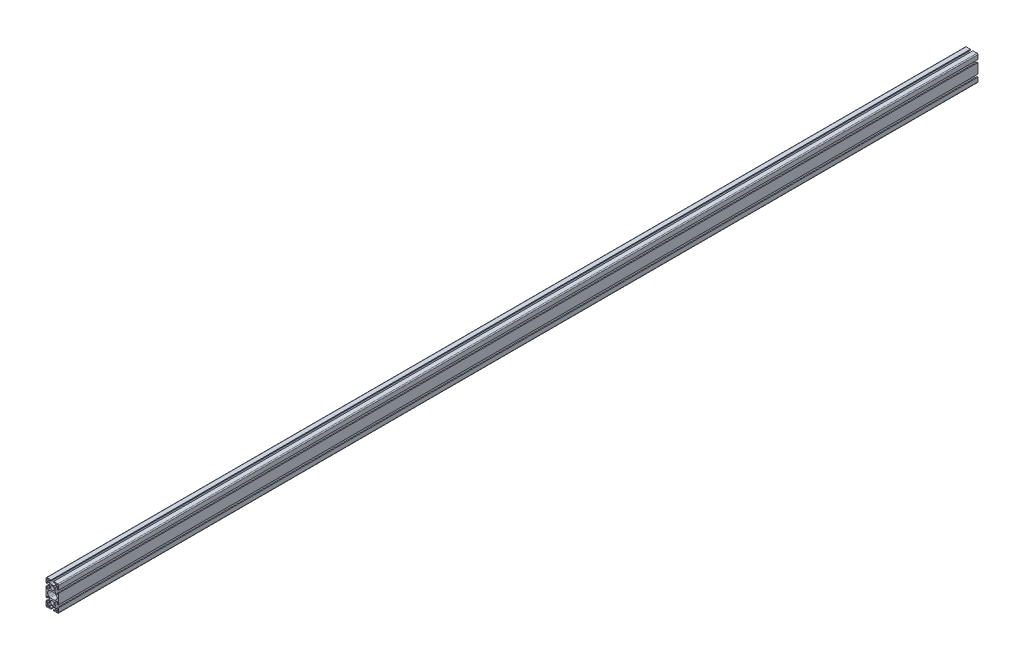
from build123d import *

# Parameters (mm, degrees)
SKETCH1_R           = 2.5
SKETCH1_R_2         = 6
BOSS_EXTRUDE1_DEPTH = 2900


with BuildPart() as part:
    # Sketch1 → Boss-Extrude1 (new body)
    with BuildSketch(Plane.XY):
        with BuildLine():
            Line((-17, -40), (-4.1, -40))
            Line((-4.1, -40), (-4.1, -37))
            Line((-4.1, -37), (-10.5, -37))
            Line((-10.5, -37), (-10.5, -33.6627417))
            ThreePointArc((-10.5, -33.6627417), (-10.378207252, -33.050448208), (-10.03137085, -32.53137085))
            Line((-10.03137085, -32.53137085), (-7.464466094, -29.964466094))
            ThreePointArc((-7.464466094, -29.964466094), (-5.84234935, -28.880602337), (-3.928932188, -28.5))
            Line((-3.928932188, -28.5), (3.928932188, -28.5))
            ThreePointArc((3.928932188, -28.5), (5.84234935, -28.880602337), (7.464466094, -29.964466094))
            Line((7.464466094, -29.964466094), (10.03137085, -32.53137085))
            ThreePointArc((10.03137085, -32.53137085), (10.378207252, -33.050448208), (10.5, -33.6627417))
            Line((10.5, -33.6627417), (10.5, -37))
            Line((10.5, -37), (4.1, -37))
            Line((4.1, -37), (4.1, -40))
            Line((4.1, -40), (17, -40))
            ThreePointArc((17, -40), (19.121320344, -39.121320344), (20, -37))
            Line((20, -37), (20, -24.1))
            Line((20, -24.1), (17, -24.1))
            Line((17, -24.1), (17, -30.5))
            Line((17, -30.5), (13.6627417, -30.5))
            ThreePointArc((13.6627417, -30.5), (13.050448208, -30.378207252), (12.53137085, -30.03137085))
            Line((12.53137085, -30.03137085), (9.964466094, -27.464466094))
            ThreePointArc((9.964466094, -27.464466094), (8.880602337, -25.84234935), (8.5, -23.928932188))
            Line((8.5, -23.928932188), (8.5, -16.071067812))
            ThreePointArc((8.5, -16.071067812), (8.880602337, -14.15765065), (9.964466094, -12.535533906))
            Line((9.964466094, -12.535533906), (12.53137085, -9.96862915))
            ThreePointArc((12.53137085, -9.96862915), (13.050448208, -9.621792748), (13.6627417, -9.5))
            Line((13.6627417, -9.5), (17, -9.5))
            Line((17, -9.5), (17, -15.9))
            Line((17, -15.9), (20, -15.9))
            Line((20, -15.9), (20, 15.9))
            Line((20, 15.9), (17, 15.9))
            Line((17, 15.9), (17, 9.5))
            Line((17, 9.5), (13.6627417, 9.5))
            ThreePointArc((13.6627417, 9.5), (13.050448208, 9.621792748), (12.53137085, 9.96862915))
            Line((12.53137085, 9.96862915), (9.964466094, 12.535533906))
            ThreePointArc((9.964466094, 12.535533906), (8.880602337, 14.15765065), (8.5, 16.071067812))
            Line((8.5, 16.071067812), (8.5, 23.928932188))
            ThreePointArc((8.5, 23.928932188), (8.880602337, 25.84234935), (9.964466094, 27.464466094))
            Line((9.964466094, 27.464466094), (12.53137085, 30.03137085))
            ThreePointArc((12.53137085, 30.03137085), (13.050448208, 30.378207252), (13.6627417, 30.5))
            Line((13.6627417, 30.5), (17, 30.5))
            Line((17, 30.5), (17, 24.1))
            Line((17, 24.1), (20, 24.1))
            Line((20, 24.1), (20, 37))
            ThreePointArc((20, 37), (19.121320344, 39.121320344), (17, 40))
            Line((17, 40), (4.1, 40))
            Line((4.1, 40), (4.1, 37))
            Line((4.1, 37), (10.5, 37))
            Line((10.5, 37), (10.5, 33.6627417))
            ThreePointArc((10.5, 33.6627417), (10.378207252, 33.050448208), (10.03137085, 32.53137085))
            Line((10.03137085, 32.53137085), (7.464466094, 29.964466094))
            ThreePointArc((7.464466094, 29.964466094), (5.84234935, 28.880602337), (3.928932188, 28.5))
            Line((3.928932188, 28.5), (-3.928932188, 28.5))
            ThreePointArc((-3.928932188, 28.5), (-5.84234935, 28.880602337), (-7.464466094, 29.964466094))
            Line((-7.464466094, 29.964466094), (-10.03137085, 32.53137085))
            ThreePointArc((-10.03137085, 32.53137085), (-10.378207252, 33.050448208), (-10.5, 33.6627417))
            Line((-10.5, 33.6627417), (-10.5, 37))
            Line((-10.5, 37), (-4.1, 37))
            Line((-4.1, 37), (-4.1, 40))
            Line((-4.1, 40), (-17, 40))
            ThreePointArc((-17, 40), (-19.121320344, 39.121320344), (-20, 37))
            Line((-20, 37), (-20, 24.1))
            Line((-20, 24.1), (-17, 24.1))
            Line((-17, 24.1), (-17, 30.5))
            Line((-17, 30.5), (-13.6627417, 30.5))
            ThreePointArc((-13.6627417, 30.5), (-13.050448208, 30.378207252), (-12.53137085, 30.03137085))
            Line((-12.53137085, 30.03137085), (-9.964466094, 27.464466094))
            ThreePointArc((-9.964466094, 27.464466094), (-8.880602337, 25.84234935), (-8.5, 23.928932188))
            Line((-8.5, 23.928932188), (-8.5, 16.071067812))
            ThreePointArc((-8.5, 16.071067812), (-8.880602337, 14.15765065), (-9.964466094, 12.535533906))
            Line((-9.964466094, 12.535533906), (-12.53137085, 9.96862915))
            ThreePointArc((-12.53137085, 9.96862915), (-13.050448208, 9.621792748), (-13.6627417, 9.5))
            Line((-13.6627417, 9.5), (-17, 9.5))
            Line((-17, 9.5), (-17, 15.9))
            Line((-17, 15.9), (-20, 15.9))
            Line((-20, 15.9), (-20, -15.9))
            Line((-20, -15.9), (-17, -15.9))
            Line((-17, -15.9), (-17, -9.5))
            Line((-17, -9.5), (-13.6627417, -9.5))
            ThreePointArc((-13.6627417, -9.5), (-13.050448208, -9.621792748), (-12.53137085, -9.96862915))
            Line((-12.53137085, -9.96862915), (-9.964466094, -12.535533906))
            ThreePointArc((-9.964466094, -12.535533906), (-8.880602337, -14.15765065), (-8.5, -16.071067812))
            Line((-8.5, -16.071067812), (-8.5, -23.928932188))
            ThreePointArc((-8.5, -23.928932188), (-8.880602337, -25.84234935), (-9.964466094, -27.464466094))
            Line((-9.964466094, -27.464466094), (-12.53137085, -30.03137085))
            ThreePointArc((-12.53137085, -30.03137085), (-13.050448208, -30.378207252), (-13.6627417, -30.5))
            Line((-13.6627417, -30.5), (-17, -30.5))
            Line((-17, -30.5), (-17, -24.1))
            Line((-17, -24.1), (-20, -24.1))
            Line((-20, -24.1), (-20, -37))
            ThreePointArc((-20, -37), (-19.121320344, -39.121320344), (-17, -40))
        make_face()
        with Locations((15, 35)):
            Circle(SKETCH1_R, mode=Mode.SUBTRACT)
        with Locations((15, -35)):
            Circle(SKETCH1_R, mode=Mode.SUBTRACT)
        with Locations((0, 20)):
            Circle(SKETCH1_R_2, mode=Mode.SUBTRACT)
        with Locations((0, -20)):
            Circle(SKETCH1_R_2, mode=Mode.SUBTRACT)
        with Locations((-15, 35)):
            Circle(SKETCH1_R, mode=Mode.SUBTRACT)
        with Locations((-15, -35)):
            Circle(SKETCH1_R, mode=Mode.SUBTRACT)
        with BuildLine():
            Line((-14.242640687, -4.242640687), (-9.949747468, -8.535533906))
            ThreePointArc((-9.949747468, -8.535533906), (-8.327630724, -9.619397663), (-6.414213562, -10))
            Line((-6.414213562, -10), (6.414213562, -10))
            ThreePointArc((6.414213562, -10), (8.327630724, -9.619397663), (9.949747468, -8.535533906))
            Line((9.949747468, -8.535533906), (14.242640687, -4.242640687))
            ThreePointArc((14.242640687, -4.242640687), (16, 0), (14.242640687, 4.242640687))
            Line((14.242640687, 4.242640687), (9.949747468, 8.535533906))
            ThreePointArc((9.949747468, 8.535533906), (8.327630724, 9.619397663), (6.414213562, 10))
            Line((6.414213562, 10), (-6.414213562, 10))
            ThreePointArc((-6.414213562, 10), (-8.327630724, 9.619397663), (-9.949747468, 8.535533906))
            Line((-9.949747468, 8.535533906), (-14.242640687, 4.242640687))
            ThreePointArc((-14.242640687, 4.242640687), (-16, 0), (-14.242640687, -4.242640687))
        make_face(mode=Mode.SUBTRACT)
    extrude(amount=-BOSS_EXTRUDE1_DEPTH)


solid = part.part
